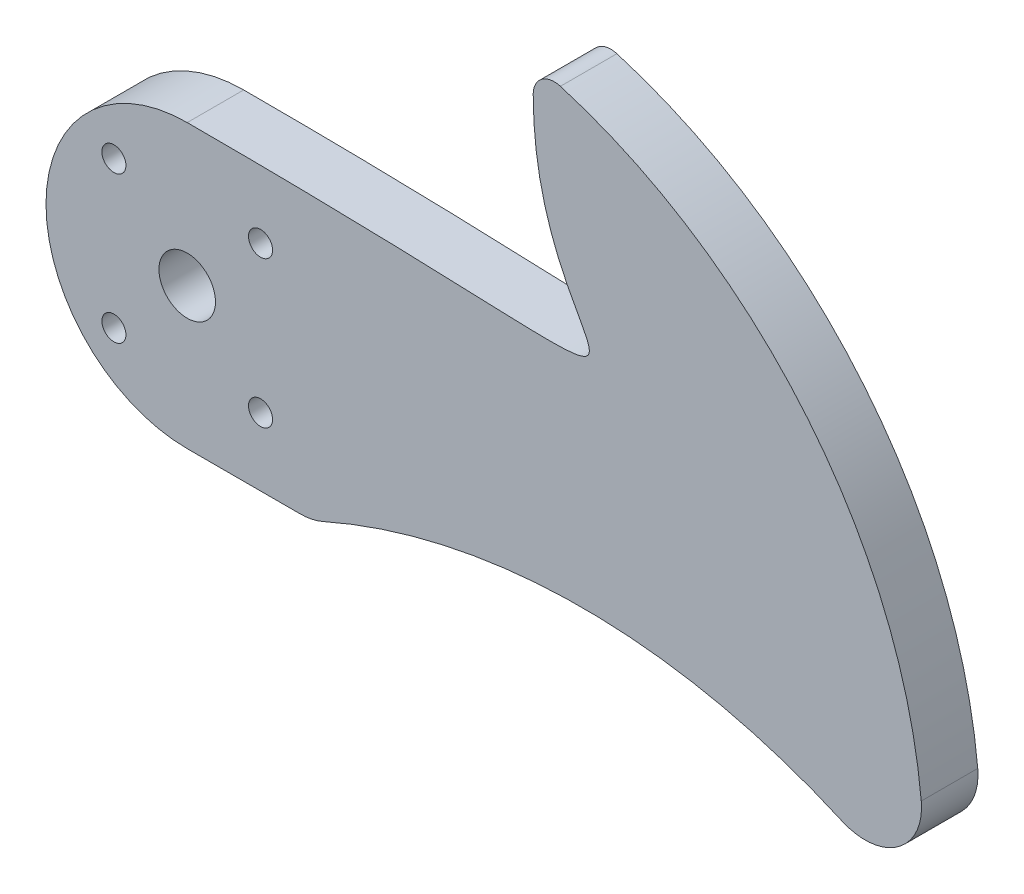
from build123d import *
from build123d.topology import SkipClean

# Parameters (mm, degrees)
SKETCH1_R             = 3.175
BOSS_EXTRUDE1_DEPTH   = 6.35
F_6_32_TAPPED_HOLE1_D = 2.7051
BOSS_EXTRUDE3_START   = 1.5875
SKETCH5_R             = 7
SKETCH5_R_2           = 3.175
BOSS_EXTRUDE3_DEPTH   = 1.5875


with BuildPart() as part:
    # Sketch1 → Boss-Extrude1 (new body)
    with BuildSketch(Plane.XY):
        with BuildLine():
            Line((0, -15.875), (12.7, -15.875))
            ThreePointArc((12.7, -15.875), (14.017406742, -15.736838655), (15.277486023, -15.328366764))
            ThreePointArc((15.277486023, -15.328366764), (44.45, -9.14146), (73.622513977, -15.328366764))
            ThreePointArc((73.622513977, -15.328366764), (79.912012711, -14.677034708), (82.52084196, -8.917170323))
            ThreePointArc((82.52084196, -8.917170323), (69.763837113, 21.925102015), (41.955075464, 40.382071192))
            ThreePointArc((41.955075464, 40.382071192), (39.851813107, 40.009159666), (38.89375, 38.1))
            add(Edge.make_bspline(
                [(38.89375, 38.1), (38.89375, 8.240619939), (68.342560944, 15.875), (0, 15.875)],
                knots=[0, 0, 0, 0, 1, 1, 1, 1], degree=3))
            ThreePointArc((0, 15.875), (-15.875, 0), (0, -15.875))
        make_face()
        Circle(SKETCH1_R, mode=Mode.SUBTRACT)
    extrude(amount=BOSS_EXTRUDE1_DEPTH)

    # #6-32 Tapped Hole1 (through all)
    with Locations(Plane.XY.offset(6.35)):
        with Locations((8.242390195, 8.242390195), (-8.242390195, 8.242390195), (8.242390195, -8.242390195), (-8.242390195, -8.242390195)):
            Hole(F_6_32_TAPPED_HOLE1_D / 2)

    # Sketch5 → Boss-Extrude3 (add)
    with SkipClean():  # the faces are left unmerged after this step: merging them gives an invalid solid
        with BuildSketch(Plane(origin=(0, 0, 0), x_dir=(-1, 0, 0), z_dir=(0, 0, -1)).offset(BOSS_EXTRUDE3_START)):
            Circle(SKETCH5_R)
            Circle(SKETCH5_R_2, mode=Mode.SUBTRACT)
        extrude(amount=-BOSS_EXTRUDE3_DEPTH)


solid = part.part
